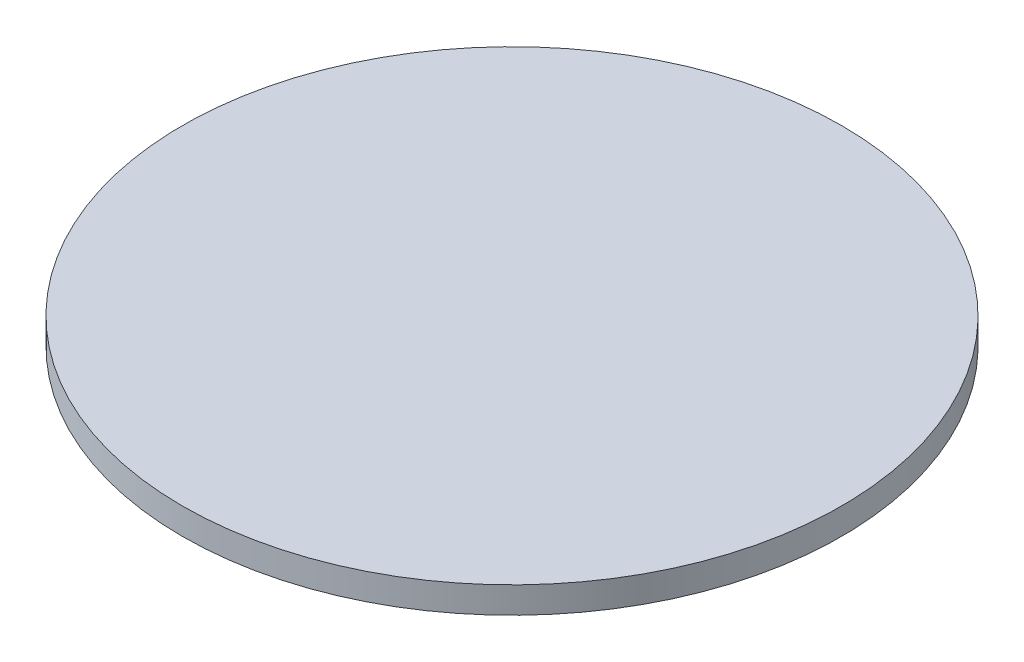
from build123d import *

# Parameters (mm, degrees)
SKETCH1_R           = 125
BOSS_EXTRUDE1_DEPTH = 10


with BuildPart() as part:
    # Sketch1 → Boss-Extrude1 (new body)
    with BuildSketch(Plane(origin=(0, 0, 0), x_dir=(1, 0, 0), z_dir=(0, 1, 0))):
        with Locations(Location((0, 0, 0), (0, 0, 270))):
            Circle(SKETCH1_R)
    extrude(amount=BOSS_EXTRUDE1_DEPTH)


solid = part.part
